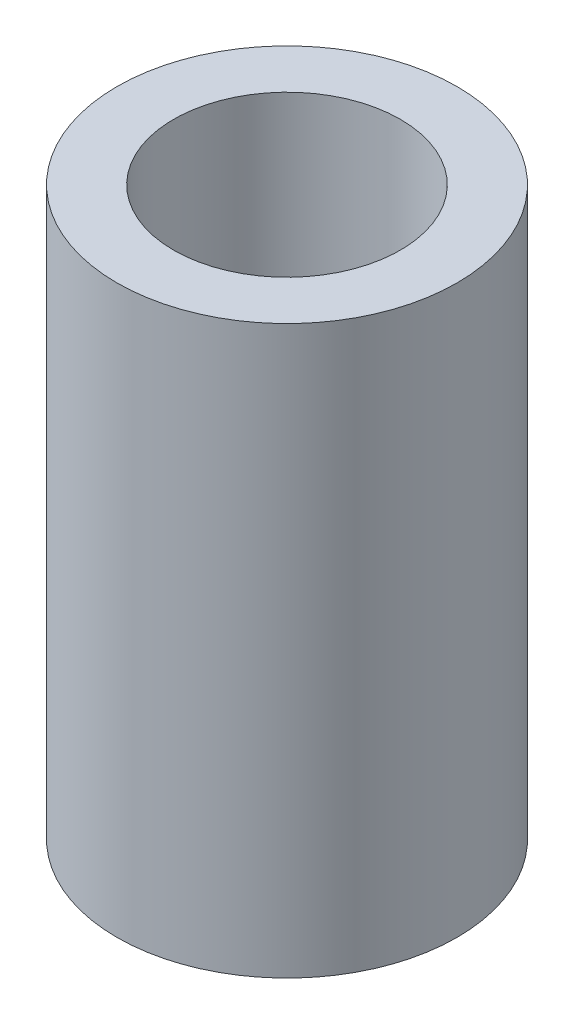
from build123d import *

# Parameters (mm, degrees)
SKETCH1_R           = 3.81
BOSS_EXTRUDE2_DEPTH = 12.7
SKETCH3_R           = 2.54
CUT_EXTRUDE2_DEPTH  = 12.7


with BuildPart() as part:
    # Sketch1 → Boss-Extrude2 (new body)
    with BuildSketch(Plane(origin=(0, 0, 0), x_dir=(1, 0, 0), z_dir=(0, 1, 0))):
        with Locations(Location((0, 0, 0), (0, 0, 270))):
            Circle(SKETCH1_R)
    extrude(amount=BOSS_EXTRUDE2_DEPTH)

    # Sketch3 → Cut-Extrude2 (cut)
    with BuildSketch(Plane(origin=(0, 12.7, 0), x_dir=(1, 0, 0), z_dir=(0, 1, 0))):
        with Locations(Location((0, 0, 0), (0, 0, 270))):
            Circle(SKETCH3_R)
    extrude(amount=-CUT_EXTRUDE2_DEPTH, mode=Mode.SUBTRACT)


solid = part.part
